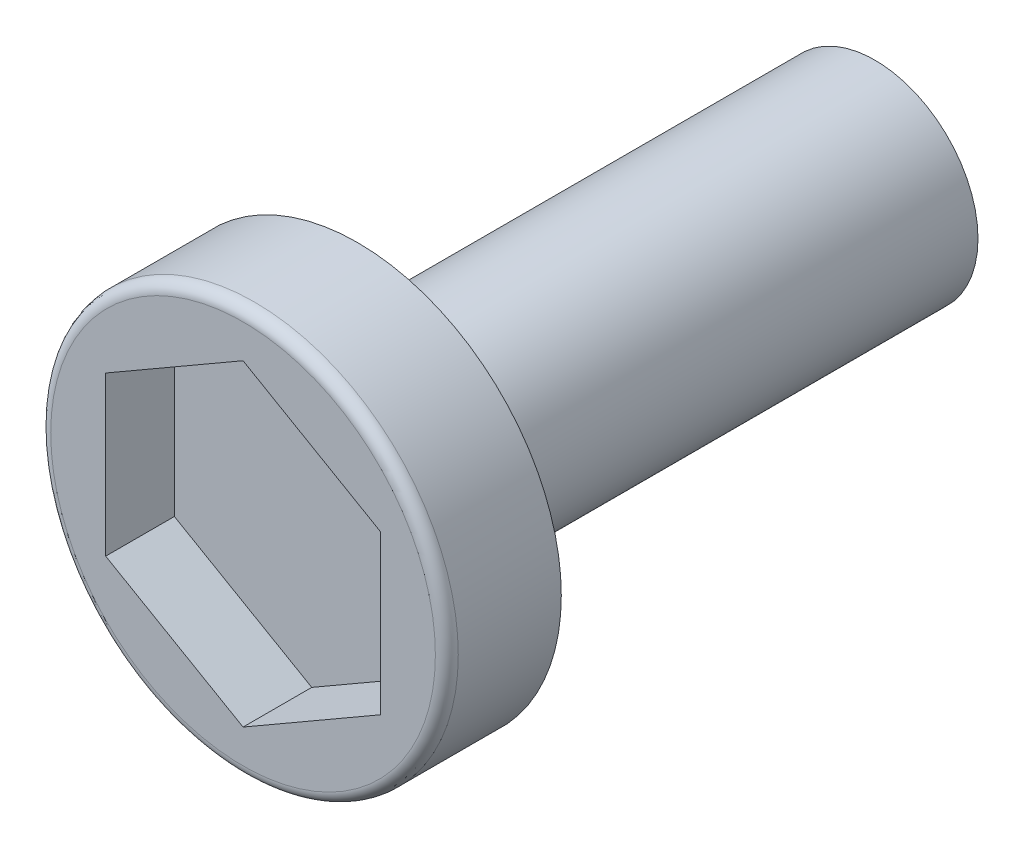
from build123d import *

# Parameters (mm, degrees)
CROQUIS1_R              = 8.9
SALIENTE_EXTRUIR1_DEPTH = 5
CORTAR_EXTRUIR1_DEPTH   = 3
REDONDEO1_R             = 0.5
CROQUIS3_R              = 4.5
SALIENTE_EXTRUIR2_DEPTH = 22.6


with BuildPart() as part:
    # Croquis1 → Saliente-Extruir1 (new body)
    with BuildSketch(Plane.XY):
        Circle(CROQUIS1_R)
    extrude(amount=SALIENTE_EXTRUIR1_DEPTH)

    # Croquis2 → Cortar-Extruir1 (cut)
    with BuildSketch(Plane.XY.offset(5)):
        Polygon((-6, -3.464101615), (0, -6.92820323), (6, -3.464101615), (6, 3.464101615), (0, 6.92820323), (-6, 3.464101615), align=None)
    extrude(amount=-CORTAR_EXTRUIR1_DEPTH, mode=Mode.SUBTRACT)

    # Redondeo1
    redondeo1_edges = [part.edges().sort_by_distance(p)[0] for p in [
        (-8.9, 0, 5),
    ]]
    fillet(redondeo1_edges, radius=REDONDEO1_R)

    # Croquis3 → Saliente-Extruir2 (add)
    with BuildSketch(Plane(origin=(0, 0, 0), x_dir=(-1, 0, 0), z_dir=(0, 0, -1))):
        Circle(CROQUIS3_R)
    extrude(amount=SALIENTE_EXTRUIR2_DEPTH)


solid = part.part
